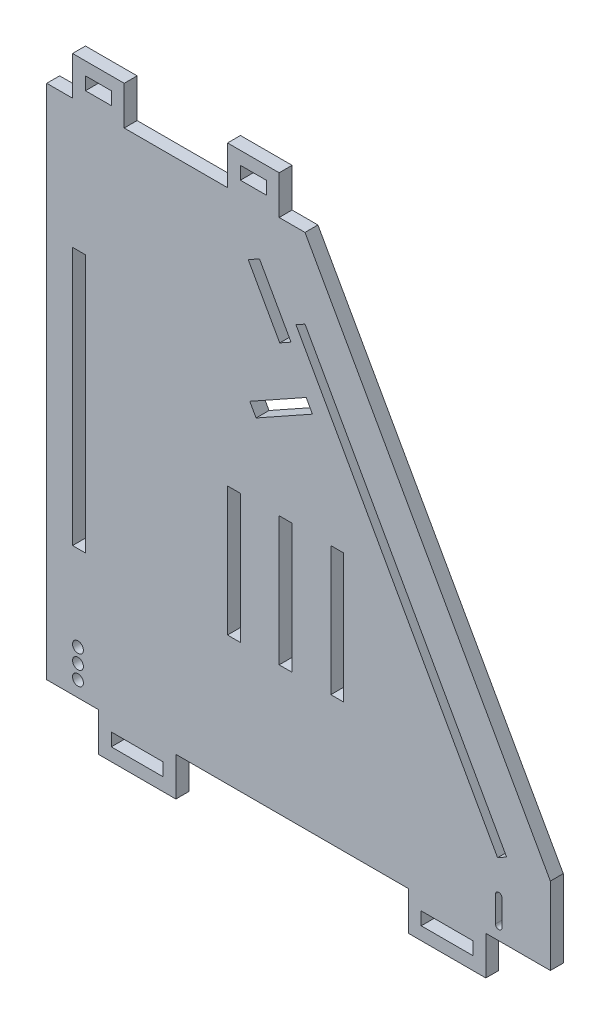
from build123d import *

# Parameters (mm, degrees)
SKETCH1_W           = 100
SKETCH1_H           = 200
SKETCH1_W_2         = 95
SKETCH1_H_2         = 30
BOSS_EXTRUDE1_DEPTH = 5
SKETCH2_R           = 2.1
CUT_EXTRUDE1_DEPTH  = 5
SKETCH3_W           = 20
SKETCH3_H           = 15
SKETCH3_W_2         = 10
SKETCH3_H_2         = 5
BOSS_EXTRUDE2_DEPTH = 5
SKETCH4_R           = 2.1
CUT_EXTRUDE2_DEPTH  = 5
SKETCH5_W           = 30
SKETCH5_H           = 15
SKETCH5_W_2         = 20
SKETCH5_H_2         = 5
BOSS_EXTRUDE3_DEPTH = 5
CUT_EXTRUDE3_DEPTH  = 5
SKETCH7_W           = 5
SKETCH7_H           = 50
CUT_EXTRUDE4_DEPTH  = 5
CUT_EXTRUDE5_DEPTH  = 5
SKETCH9_W           = 5
SKETCH9_H           = 100
CUT_EXTRUDE6_DEPTH  = 5
CUT_EXTRUDE7_DEPTH  = 5


with BuildPart() as part:
    # Sketch1 → Boss-Extrude1 (new body)
    with BuildSketch(Plane.XY):
        Polygon((100, 30), (195, 30), (100, 200), align=None)
        with Locations((50, 100)):
            Rectangle(SKETCH1_W, SKETCH1_H)
        with Locations((147.5, 15)):
            Rectangle(SKETCH1_W_2, SKETCH1_H_2)
    extrude(amount=BOSS_EXTRUDE1_DEPTH)

    # Sketch2 → Cut-Extrude1 (cut)
    with BuildSketch(Plane.XY.offset(5)):
        with Locations((12.1, 6)):
            Circle(SKETCH2_R)
    extrude(amount=-CUT_EXTRUDE1_DEPTH, mode=Mode.SUBTRACT)

    # Sketch3 → Boss-Extrude2 (add)
    # profile 1 of 2: a face of its own
    with BuildSketch(Plane.XY.offset(5)):
        with Locations((20, 207.5)):
            Rectangle(SKETCH3_W, SKETCH3_H)
        with Locations((20, 207.5)):
            Rectangle(SKETCH3_W_2, SKETCH3_H_2, mode=Mode.SUBTRACT)
    # profile 2 of 2: a face of its own
    with BuildSketch(Plane.XY.offset(5)):
        with Locations((80, 207.5)):
            Rectangle(SKETCH3_W, SKETCH3_H)
        with Locations((80, 207.5)):
            Rectangle(SKETCH3_W_2, SKETCH3_H_2, mode=Mode.SUBTRACT)
    extrude(amount=-BOSS_EXTRUDE2_DEPTH)

    # Sketch4 → Cut-Extrude2 (cut)
    with BuildSketch(Plane.XY.offset(5)):
        with Locations((12.1, 11.5)):
            Circle(SKETCH4_R)
        with Locations((12.1, 17)):
            Circle(SKETCH4_R)
    extrude(amount=-CUT_EXTRUDE2_DEPTH, mode=Mode.SUBTRACT)

    # Sketch5 → Boss-Extrude3 (add)
    # profile 1 of 2: a face of its own
    with BuildSketch(Plane.XY.offset(5)):
        with Locations((35, -7.5)):
            Rectangle(SKETCH5_W, SKETCH5_H)
        with Locations((35, -7.5)):
            Rectangle(SKETCH5_W_2, SKETCH5_H_2, mode=Mode.SUBTRACT)
    # profile 2 of 2: a face of its own
    with BuildSketch(Plane.XY.offset(5)):
        with Locations((155, -7.5)):
            Rectangle(SKETCH5_W, SKETCH5_H)
        with Locations((155, -7.5)):
            Rectangle(SKETCH5_W_2, SKETCH5_H_2, mode=Mode.SUBTRACT)
    extrude(amount=-BOSS_EXTRUDE3_DEPTH)

    # Sketch6 → Cut-Extrude3 (cut)
    with BuildSketch(Plane.XY.offset(5)):
        Polygon((100, 169.251038799), (178.051417226, 29.580081657), (174.559643298, 27.628796226), (96.508226071, 167.299753368), align=None)
    extrude(amount=-CUT_EXTRUDE3_DEPTH, mode=Mode.SUBTRACT)

    # Sketch7 → Cut-Extrude4 (cut)
    with BuildSketch(Plane.XY.offset(5)):
        with Locations((72.5, 75)):
            Rectangle(SKETCH7_W, SKETCH7_H)
        with Locations((92.5, 75)):
            Rectangle(SKETCH7_W, SKETCH7_H)
        with Locations((112.5, 75)):
            Rectangle(SKETCH7_W, SKETCH7_H)
    extrude(amount=-CUT_EXTRUDE4_DEPTH, mode=Mode.SUBTRACT)

    # Sketch8 → Cut-Extrude5 (cut)
    with BuildSketch(Plane.XY.offset(5)):
        with BuildLine():
            Line((176.25, 15), (176.25, 5))
            ThreePointArc((176.25, 5), (175, 3.75), (173.75, 5))
            Line((173.75, 5), (173.75, 15))
            ThreePointArc((173.75, 15), (175, 16.25), (176.25, 15))
        make_face()
    extrude(amount=-CUT_EXTRUDE5_DEPTH, mode=Mode.SUBTRACT)

    # Sketch9 → Cut-Extrude6 (cut)
    with BuildSketch(Plane.XY.offset(5)):
        Polygon((78.625722092, 132.677274378), (100.449309145, 144.87280832), (102.888415934, 140.508090909), (81.06482888, 128.312556967), align=None)
        with Locations((12.5, 100)):
            Rectangle(SKETCH9_W, SKETCH9_H)
    extrude(amount=-CUT_EXTRUDE6_DEPTH, mode=Mode.SUBTRACT)

    # Sketch10 → Cut-Extrude7 (cut)
    with BuildSketch(Plane(origin=(0, 0, 0), x_dir=(-1, 0, 0), z_dir=(0, 0, -1))):
        Polygon((-94.582615449, 160.495929169), (-82.387081507, 182.319516222), (-78.022364097, 179.880409434), (-90.217898038, 158.056822381), align=None)
    extrude(amount=-CUT_EXTRUDE7_DEPTH, mode=Mode.SUBTRACT)


solid = part.part
